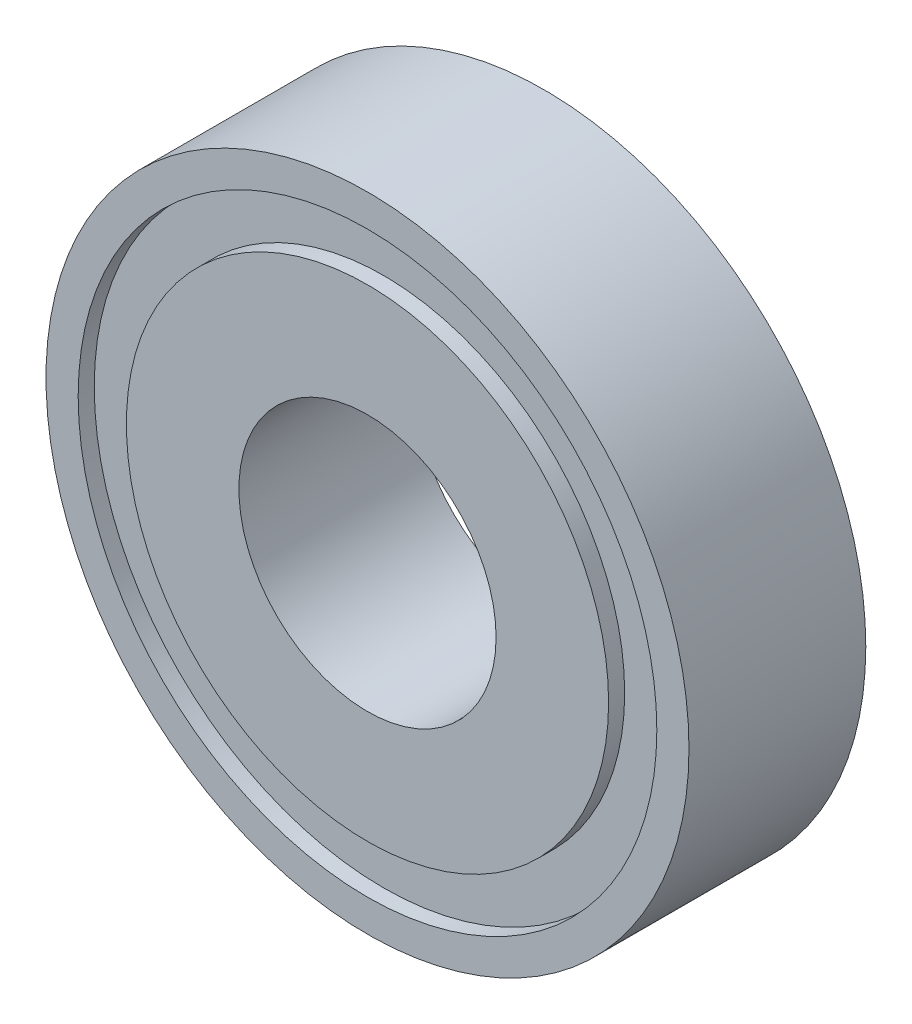
from build123d import *

# Parameters (mm, degrees)
SKETCH_1_R          = 20
SKETCH_1_R_2        = 8
EXTRUDE_1_DEPTH     = 11
SKETCH_2_R          = 18
SKETCH_2_R_2        = 15
CUT_EXTRUDE_1_DEPTH = 1


with BuildPart() as part:
    # 草图1 → 凸台-拉伸1 (new body)
    with BuildSketch(Plane.XY):
        Circle(SKETCH_1_R)
        Circle(SKETCH_1_R_2, mode=Mode.SUBTRACT)
    extrude(amount=EXTRUDE_1_DEPTH)

    # 草图2 → 切除-拉伸1 (cut)
    with BuildSketch(Plane.XY.offset(11)):
        Circle(SKETCH_2_R)
        Circle(SKETCH_2_R_2, mode=Mode.SUBTRACT)
    extrude(amount=-CUT_EXTRUDE_1_DEPTH, mode=Mode.SUBTRACT)


solid = part.part
